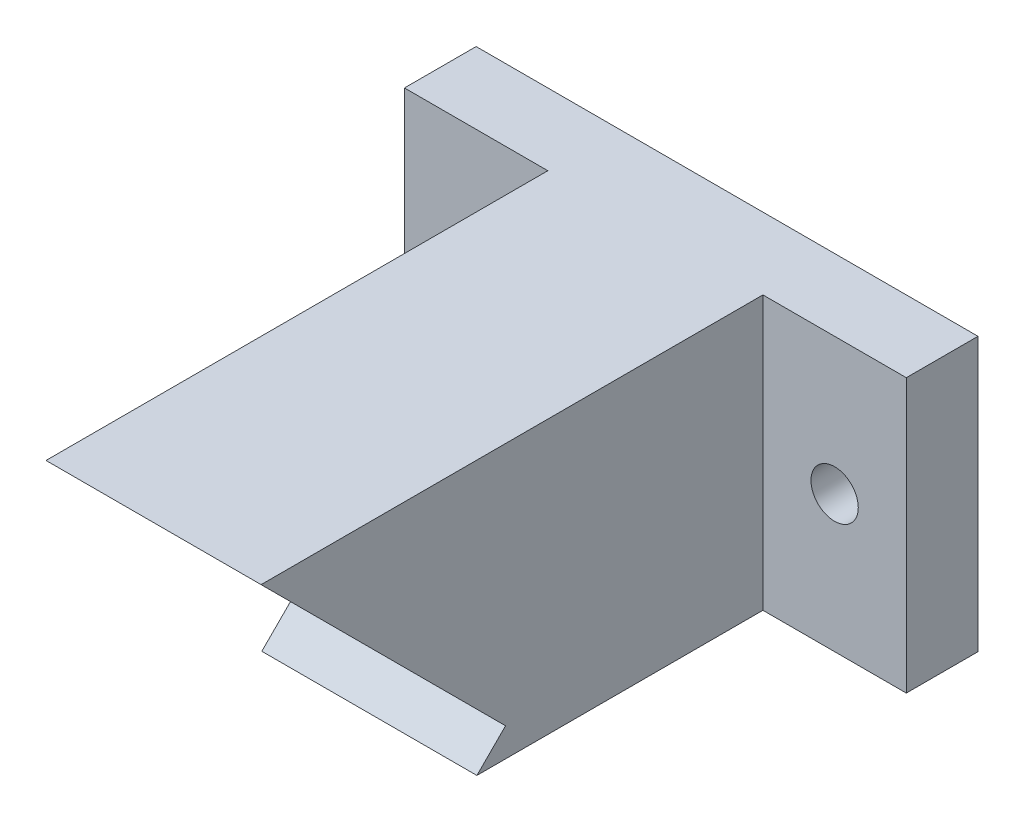
from build123d import *

# Parameters (mm, degrees)
SKETCH1_W             = 15
SKETCH1_H             = 10
BOSS_EXTRUDE1_DEPTH   = 40
CUT_EXTRUDE1_DEPTH    = 40
BOSS_EXTRUDE2_DEPTH   = 15
SKETCH4_W             = 15
SKETCH4_H             = 24.5
BOSS_EXTRUDE3_DEPTH   = 2
SKETCH5_W             = 11
SKETCH5_H             = 15.050743374
CUT_EXTRUDE2_DEPTH    = 44.054307443
SKETCH6_W             = 10
SKETCH6_H             = 19.050743374
SKETCH6_W_2           = 15
SKETCH6_W_3           = 11
SKETCH6_H_2           = 15.050743374
BOSS_EXTRUDE4_DEPTH   = 5
M4X0_7_TAPPED_HOLE1_D = 3.3
M4X0_7_TAPPED_HOLE2_D = 3.3
CUT_EXTRUDE3_DEPTH    = 50.218120539
BOSS_EXTRUDE5_DEPTH   = 15


with BuildPart() as part:
    # Sketch1 → Boss-Extrude1 (new body)
    with BuildSketch(Plane.XY):
        Rectangle(SKETCH1_W, SKETCH1_H)
    extrude(amount=BOSS_EXTRUDE1_DEPTH)

    # Sketch2 → Cut-Extrude1 (cut)
    with BuildSketch(Plane(origin=(7.5, 0, 0), x_dir=(0, 0, -1), z_dir=(1, 0, 0))):
        Polygon((-40, 5), (-40, -5), (-30, -5), align=None)
    extrude(amount=-CUT_EXTRUDE1_DEPTH, mode=Mode.SUBTRACT)

    # Sketch3 → Boss-Extrude2 (add, through all)
    with BuildSketch(Plane.ZY.offset(7.5)):
        Polygon((0, -12.050743374), (0, -5), (30, -5), (25.477447389, -9.522552611), (22.949256626, -12.050743374), align=None)
    extrude(amount=-BOSS_EXTRUDE2_DEPTH)

    # Sketch4 → Boss-Extrude3 (add)
    with BuildSketch(Plane(origin=(0, -12.050743374, 0), x_dir=(-1, 0, 0), z_dir=(0, -1, 0))):
        with Locations((0, -12.25)):
            Rectangle(SKETCH4_W, SKETCH4_H)
    extrude(amount=BOSS_EXTRUDE3_DEPTH)

    # Sketch5 → Cut-Extrude2 (cut, through all)
    with BuildSketch(Plane(origin=(0, 0, 0), x_dir=(-1, 0, 0), z_dir=(0, 0, -1))):
        with Locations((0, -4.525371687)):
            Rectangle(SKETCH5_W, SKETCH5_H)
    extrude(amount=-CUT_EXTRUDE2_DEPTH, mode=Mode.SUBTRACT)

    # Sketch6 → Boss-Extrude4 (add)
    # profile 1 of 4: a face of its own
    with BuildSketch(Plane(origin=(0, 0, 0), x_dir=(-1, 0, 0), z_dir=(0, 0, -1))):
        with Locations((-12.5, -4.525371687)):
            Rectangle(SKETCH6_W, SKETCH6_H)
    # profile 2 of 4: a face of its own
    with BuildSketch(Plane(origin=(0, 0, 0), x_dir=(-1, 0, 0), z_dir=(0, 0, -1))):
        with Locations((12.5, -4.525371687)):
            Rectangle(SKETCH6_W, SKETCH6_H)
    # profile 3 of 4: a face of its own
    with BuildSketch(Plane(origin=(0, 0, 0), x_dir=(-1, 0, 0), z_dir=(0, 0, -1))):
        with Locations((0, -4.525371687)):
            Rectangle(SKETCH6_W_2, SKETCH6_H)
        with Locations((0, -4.525371687)):
            Rectangle(SKETCH6_W_3, SKETCH6_H_2, mode=Mode.SUBTRACT)
    # profile 4 of 4: a face of its own
    with BuildSketch(Plane(origin=(0, 0, 0), x_dir=(-1, 0, 0), z_dir=(0, 0, -1))):
        with Locations((0, -4.525371687)):
            Rectangle(SKETCH6_W_3, SKETCH6_H_2)
    extrude(amount=-BOSS_EXTRUDE4_DEPTH)

    # M4x0.7 Tapped Hole1 (through all)
    with Locations(Plane.XY.offset(5)):
        with Locations((-12.5, -4.525371687)):
            Hole(M4X0_7_TAPPED_HOLE1_D / 2)

    # M4x0.7 Tapped Hole2 (through all)
    with Locations(Plane.XY.offset(5)):
        with Locations((12.5, -4.525371687)):
            Hole(M4X0_7_TAPPED_HOLE2_D / 2)

    # Sketch13 → Cut-Extrude3 (cut, through all)
    with BuildSketch(Plane.ZY.offset(7.5)):
        Polygon((22.949256626, -12.050743374), (24.5, -14.050743374), (24.5, -12.050743374), align=None)
    extrude(amount=-CUT_EXTRUDE3_DEPTH, mode=Mode.SUBTRACT)

    # Sketch14 → Boss-Extrude5 (add)
    with BuildSketch(Plane.ZY.offset(7.5)):
        Polygon((22.949256626, -12.050743374), (22.949256626, -14.050743374), (24.949256626, -14.050743374), align=None)
    extrude(amount=-BOSS_EXTRUDE5_DEPTH)


solid = part.part
